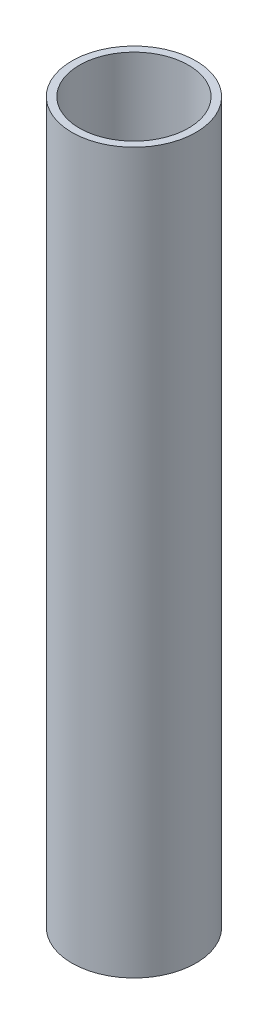
from build123d import *

# Parameters (mm, degrees)
SKETCH_1_R      = 12.5
SKETCH_1_R_2    = 11
EXTRUDE_1_DEPTH = 145


with BuildPart() as part:
    # 草图1 → 凸台-拉伸1 (new body)
    with BuildSketch(Plane(origin=(0, 0, 0), x_dir=(1, 0, 0), z_dir=(0, 1, 0))):
        with Locations(Location((0, 0, 0), (0, 0, 270))):
            Circle(SKETCH_1_R)
        with Locations(Location((0, 0, 0), (0, 0, 270))):
            Circle(SKETCH_1_R_2, mode=Mode.SUBTRACT)
    extrude(amount=EXTRUDE_1_DEPTH)


solid = part.part
